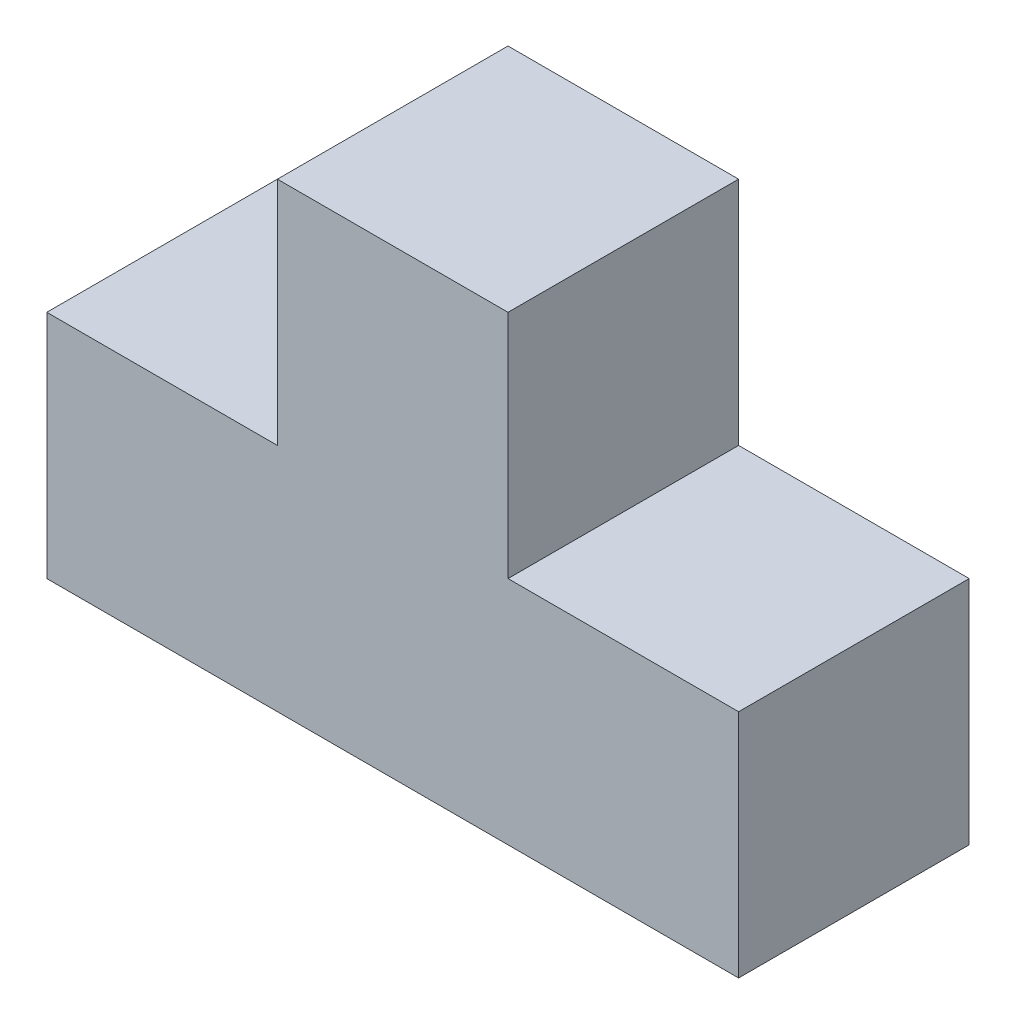
from build123d import *

# Parameters (mm, degrees)
EXTRUDE_1_DEPTH      = 15
EXTRUDE_1_DEPTH_BACK = 15


with BuildPart() as part:
    # 草圖1 → 擠出1 (new, two sides: drawn at the far end of the back side and taken through both)
    with BuildSketch(Plane.XY.offset(-EXTRUDE_1_DEPTH_BACK)):
        Polygon((-45, 0), (45, 0), (45, 30), (15, 30), (15, 60), (-15, 60), (-15, 30), (-45, 30), align=None)
    extrude(amount=EXTRUDE_1_DEPTH + EXTRUDE_1_DEPTH_BACK)


solid = part.part
